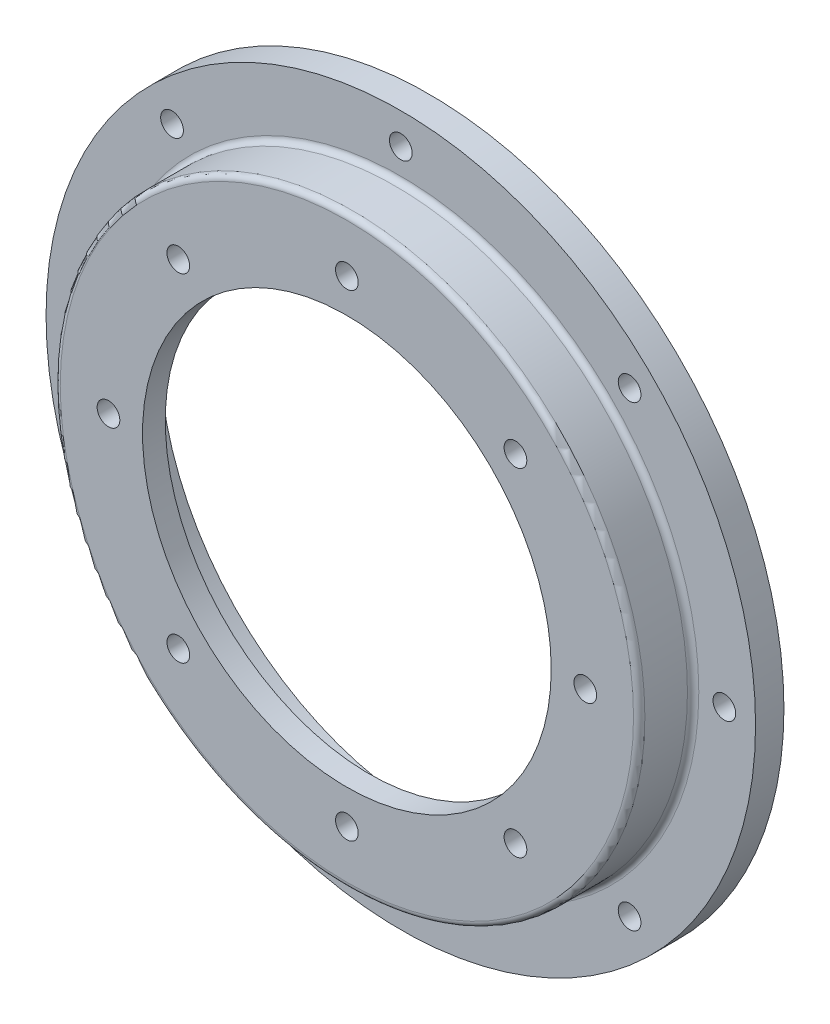
from build123d import *

# Parameters (mm, degrees)
SKETCH1_R                       = 62.5
SKETCH1_R_2                     = 36
BOSS_EXTRUDE1_DEPTH             = 5
SKETCH1_4_R                     = 51.5
SKETCH1_4_R_2                   = 36
BOSS_EXTRUDE2_DEPTH             = 14.5
F_4_0MM_DOWEL_HOLE3_D           = 4
F_4_0MM_DOWEL_HOLE3_CSINK_D     = 4.05
F_4_0MM_DOWEL_HOLE3_CSINK_ANGLE = 90
SKETCH11_R                      = 47.5
SKETCH11_R_2                    = 36
CUT_EXTRUDE4_DEPTH              = 10.5
FILLET1_R                       = 1


with BuildPart() as part:
    # Sketch1 → Boss-Extrude1 (new body)
    with BuildSketch(Plane.XY):
        Circle(SKETCH1_R)
        Circle(SKETCH1_R_2, mode=Mode.SUBTRACT)
    extrude(amount=BOSS_EXTRUDE1_DEPTH)

    # Sketch1<4> → Boss-Extrude2 (add)
    with BuildSketch(Plane.XY):
        Circle(SKETCH1_4_R)
        Circle(SKETCH1_4_R_2, mode=Mode.SUBTRACT)
    extrude(amount=BOSS_EXTRUDE2_DEPTH)

    # Ø4.0mm Dowel Hole3 (through all)
    with Locations(Plane(origin=(0, 0, 0), x_dir=(-1, 0, 0), z_dir=(0, 0, -1))):
        with Locations((0, 57), (0, 42), (40.305086528, 40.305086528), (29.69848481, 29.69848481), (42, 0), (57, 0), (40.305086528, -40.305086528), (29.69848481, -29.69848481), (0, -42), (0, -57), (-29.69848481, -29.69848481), (-40.305086528, -40.305086528), (-42, 0), (-57, 0), (-29.69848481, 29.69848481), (-40.305086528, 40.305086528)):
            CounterSinkHole(F_4_0MM_DOWEL_HOLE3_D / 2, F_4_0MM_DOWEL_HOLE3_CSINK_D / 2, counter_sink_angle=F_4_0MM_DOWEL_HOLE3_CSINK_ANGLE)

    # Sketch11 → Cut-Extrude4 (cut)
    with BuildSketch(Plane.XY):
        Circle(SKETCH11_R)
        Circle(SKETCH11_R_2, mode=Mode.SUBTRACT)
    extrude(amount=CUT_EXTRUDE4_DEPTH, mode=Mode.SUBTRACT)

    # Fillet1
    fillet1_edges = [part.edges().sort_by_distance(p)[0] for p in [
        (-47.5, 0, 10.5),
        (-51.5, 0, 5),
        (-51.5, 0, 14.5),
    ]]
    fillet(fillet1_edges, radius=FILLET1_R)


solid = part.part
